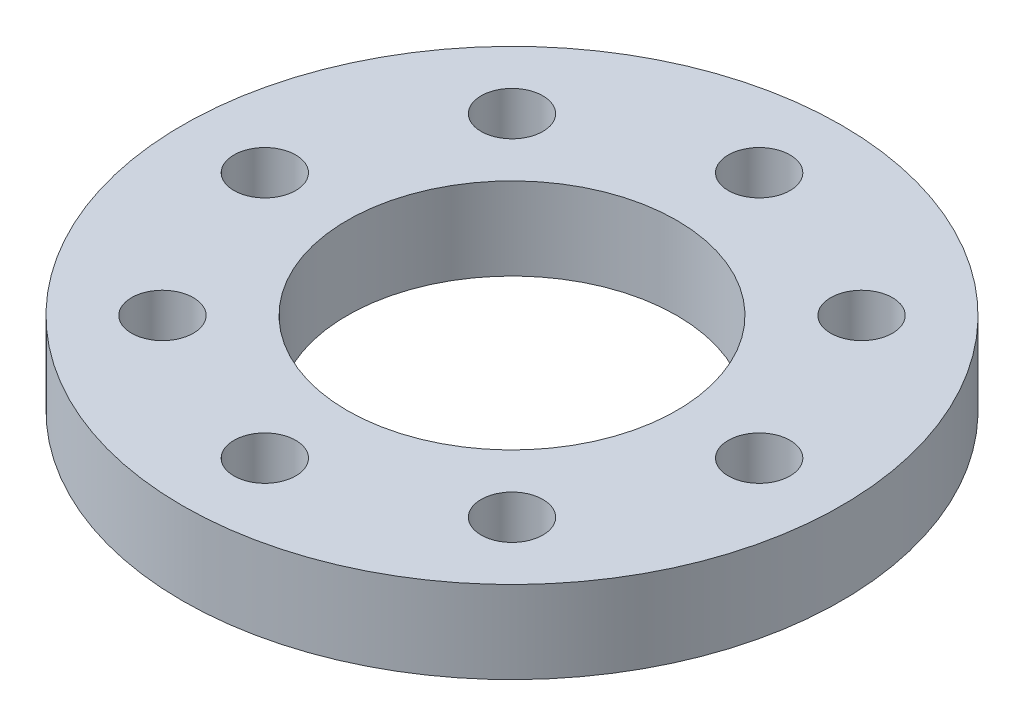
from build123d import *

# Parameters (mm, degrees)
SKETCH1_R           = 203.2
SKETCH1_R_2         = 19.05
SKETCH1_R_3         = 101.6
BOSS_EXTRUDE1_DEPTH = 50.8


with BuildPart() as part:
    # Sketch1 → Boss-Extrude1 (new body)
    with BuildSketch(Plane(origin=(0, 0, 0), x_dir=(1, 0, 0), z_dir=(0, 1, 0))):
        with Locations(Location((0, 0, 0), (0, 0, 270))):
            Circle(SKETCH1_R)
        with Locations(Location((-107.763073453, 107.763073453, 0), (0, 0, 270))):
            Circle(SKETCH1_R_2, mode=Mode.SUBTRACT)
        with Locations(Location((-152.4, 0, 0), (0, 0, 270))):
            Circle(SKETCH1_R_2, mode=Mode.SUBTRACT)
        with Locations(Location((-107.763073453, -107.763073453, 0), (0, 0, 270))):
            Circle(SKETCH1_R_2, mode=Mode.SUBTRACT)
        with Locations(Location((0, -152.4, 0), (0, 0, 270))):
            Circle(SKETCH1_R_2, mode=Mode.SUBTRACT)
        with Locations(Location((107.763073453, -107.763073453, 0), (0, 0, 270))):
            Circle(SKETCH1_R_2, mode=Mode.SUBTRACT)
        with Locations(Location((152.4, 0, 0), (0, 0, 270))):
            Circle(SKETCH1_R_2, mode=Mode.SUBTRACT)
        with Locations(Location((107.763073453, 107.763073453, 0), (0, 0, 270))):
            Circle(SKETCH1_R_2, mode=Mode.SUBTRACT)
        with Locations(Location((0, 152.4, 0), (0, 0, 270))):
            Circle(SKETCH1_R_2, mode=Mode.SUBTRACT)
        with Locations(Location((0, 0, 0), (0, 0, 270))):
            Circle(SKETCH1_R_3, mode=Mode.SUBTRACT)
    extrude(amount=BOSS_EXTRUDE1_DEPTH)


solid = part.part
